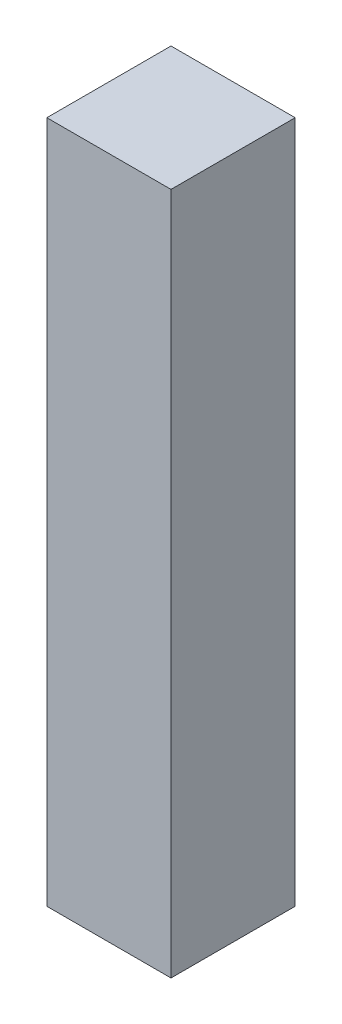
from build123d import *

# Parameters (mm, degrees)
CROQUIS1_W              = 5
CROQUIS1_H              = 5
SALIENTE_EXTRUIR1_DEPTH = 13.75


with BuildPart() as part:
    # Croquis1 → Saliente-Extruir1 (new, symmetric)
    with BuildSketch(Plane(origin=(0, 0, 0), x_dir=(1, 0, 0), z_dir=(0, 1, 0))):
        Rectangle(CROQUIS1_W, CROQUIS1_H)
    extrude(amount=SALIENTE_EXTRUIR1_DEPTH, both=True)


solid = part.part
